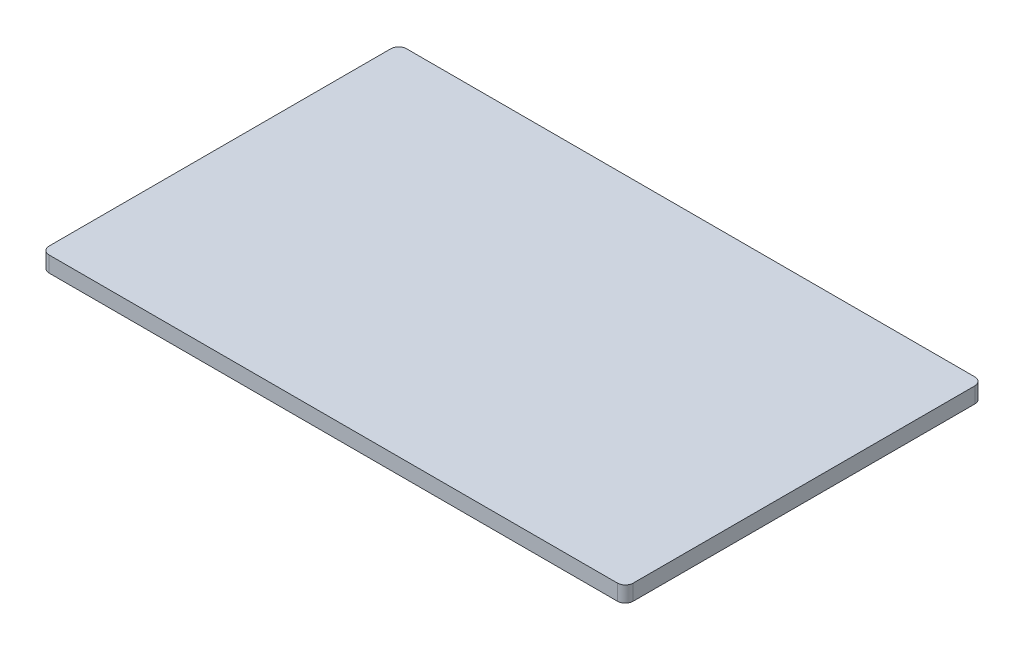
from build123d import *

# Parameters (mm, degrees)
SZKIC1_W                    = 74.2
SZKIC1_H                    = 45.4
DODANIE_WYCI_GNI_CIE1_DEPTH = 2
ZAOKR_GLENIE1_R             = 1


with BuildPart() as part:
    # Szkic1 → Dodanie-wyciągnięcie1 (new body)
    with BuildSketch(Plane(origin=(0, 0, 0), x_dir=(1, 0, 0), z_dir=(0, 1, 0))):
        with Locations((-27.498947069, 18.854068499)):
            Rectangle(SZKIC1_W, SZKIC1_H)
    extrude(amount=DODANIE_WYCI_GNI_CIE1_DEPTH)

    # Zaokrąglenie1
    zaokr_glenie1_edges = [part.edges().sort_by_distance(p)[0] for p in [
        (-64.598947069, 1, -41.554068499),
        (9.601052931, 1, -41.554068499),
        (9.601052931, 1, 3.845931501),
        (-64.598947069, 1, 3.845931501),
    ]]
    fillet(zaokr_glenie1_edges, radius=ZAOKR_GLENIE1_R)


solid = part.part
